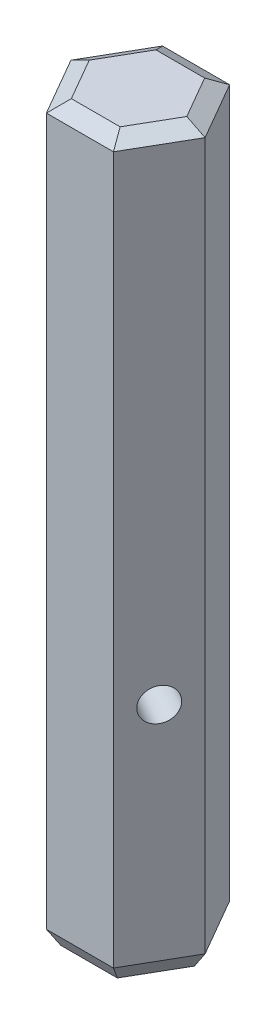
from build123d import *
from OCP.BRepFilletAPI import BRepFilletAPI_MakeChamfer

# Parameters (mm, degrees)
P_IDAT_VYSUNUT_M1_DEPTH  = 40
ZKOSEN_1_SIZE            = 0.5
ZKOSEN_1_SIZE2           = 0.866025404
SKICA2_R                 = 0.9
ODEBRAT_VYSUNUT_M1_DEPTH = 41.790243421


with BuildPart() as part:
    # Skica1 → Přidat vysunutím1 (new body)
    with BuildSketch(Plane(origin=(0, 0, 0), x_dir=(1, 0, 0), z_dir=(0, 1, 0))):
        Polygon((3.666174209, 0), (1.833087105, 3.175), (-1.833087105, 3.175), (-3.666174209, 0), (-1.833087105, -3.175), (1.833087105, -3.175), align=None)
    extrude(amount=P_IDAT_VYSUNUT_M1_DEPTH)

    # Zkosení1: one chamfer whose edges measure the first distance from different faces: ONE call of the kernel's chamfer builder (chamfer() names one face for all edges)
    zkosen_1_edges_1 = [part.edges().sort_by_distance(p)[0] for p in [
        (0, 40, -3.175),
    ]]
    zkosen_1_side_1 = [part.faces().sort_by_distance(p)[0] for p in [
        (0, 20, -3.175),
    ]]
    zkosen_1_edges_2 = [part.edges().sort_by_distance(p)[0] for p in [
        (-2.749630657, 40, -1.5875),
    ]]
    zkosen_1_side_2 = [part.faces().sort_by_distance(p)[0] for p in [
        (-2.749630657, 20, -1.5875),
    ]]
    zkosen_1_edges_3 = [part.edges().sort_by_distance(p)[0] for p in [
        (-2.749630657, 40, 1.5875),
    ]]
    zkosen_1_side_3 = [part.faces().sort_by_distance(p)[0] for p in [
        (-2.749630657, 20, 1.5875),
    ]]
    zkosen_1_edges_4 = [part.edges().sort_by_distance(p)[0] for p in [
        (0, 40, 3.175),
    ]]
    zkosen_1_side_4 = [part.faces().sort_by_distance(p)[0] for p in [
        (0, 20, 3.175),
    ]]
    zkosen_1_edges_5 = [part.edges().sort_by_distance(p)[0] for p in [
        (2.749630657, 40, 1.5875),
    ]]
    zkosen_1_side_5 = [part.faces().sort_by_distance(p)[0] for p in [
        (2.749630657, 20, 1.5875),
    ]]
    zkosen_1_edges_6 = [part.edges().sort_by_distance(p)[0] for p in [
        (0, 0, 3.175),
        (-2.749630657, 0, 1.5875),
        (-2.749630657, 0, -1.5875),
        (0, 0, -3.175),
        (2.749630657, 0, -1.5875),
        (2.749630657, 0, 1.5875),
    ]]
    zkosen_1_side_6 = [part.faces().sort_by_distance(p)[0] for p in [
        (0, 0, 0),
    ]]
    zkosen_1_edges_7 = [part.edges().sort_by_distance(p)[0] for p in [
        (2.749630657, 40, -1.5875),
    ]]
    zkosen_1_side_7 = [part.faces().sort_by_distance(p)[0] for p in [
        (2.749630657, 20, -1.5875),
    ]]
    zkosen_1 = BRepFilletAPI_MakeChamfer(part.part.solid().wrapped)
    for e in zkosen_1_edges_1:
        zkosen_1.Add(ZKOSEN_1_SIZE, ZKOSEN_1_SIZE2, e.wrapped, zkosen_1_side_1[0].wrapped)  # the first distance lies on this face
    for e in zkosen_1_edges_2:
        zkosen_1.Add(ZKOSEN_1_SIZE, ZKOSEN_1_SIZE2, e.wrapped, zkosen_1_side_2[0].wrapped)  # the first distance lies on this face
    for e in zkosen_1_edges_3:
        zkosen_1.Add(ZKOSEN_1_SIZE, ZKOSEN_1_SIZE2, e.wrapped, zkosen_1_side_3[0].wrapped)  # the first distance lies on this face
    for e in zkosen_1_edges_4:
        zkosen_1.Add(ZKOSEN_1_SIZE, ZKOSEN_1_SIZE2, e.wrapped, zkosen_1_side_4[0].wrapped)  # the first distance lies on this face
    for e in zkosen_1_edges_5:
        zkosen_1.Add(ZKOSEN_1_SIZE, ZKOSEN_1_SIZE2, e.wrapped, zkosen_1_side_5[0].wrapped)  # the first distance lies on this face
    for e in zkosen_1_edges_6:
        zkosen_1.Add(ZKOSEN_1_SIZE, ZKOSEN_1_SIZE2, e.wrapped, zkosen_1_side_6[0].wrapped)  # the first distance lies on this face
    for e in zkosen_1_edges_7:
        zkosen_1.Add(ZKOSEN_1_SIZE, ZKOSEN_1_SIZE2, e.wrapped, zkosen_1_side_7[0].wrapped)  # the first distance lies on this face
    add(Compound.cast(zkosen_1.Shape()), mode=Mode.REPLACE)

    # Skica2 → Odebrat vysunutím1 (cut, through all)
    with BuildSketch(Plane(origin=(2.749630657, 0, 1.5875), x_dir=(0.49999999999999517, 0, -0.8660254037844415), z_dir=(0.8660254037844414, 0, 0.4999999999999951))):
        with Locations((0, 13)):
            Circle(SKICA2_R)
    extrude(amount=-ODEBRAT_VYSUNUT_M1_DEPTH, mode=Mode.SUBTRACT)


solid = part.part
